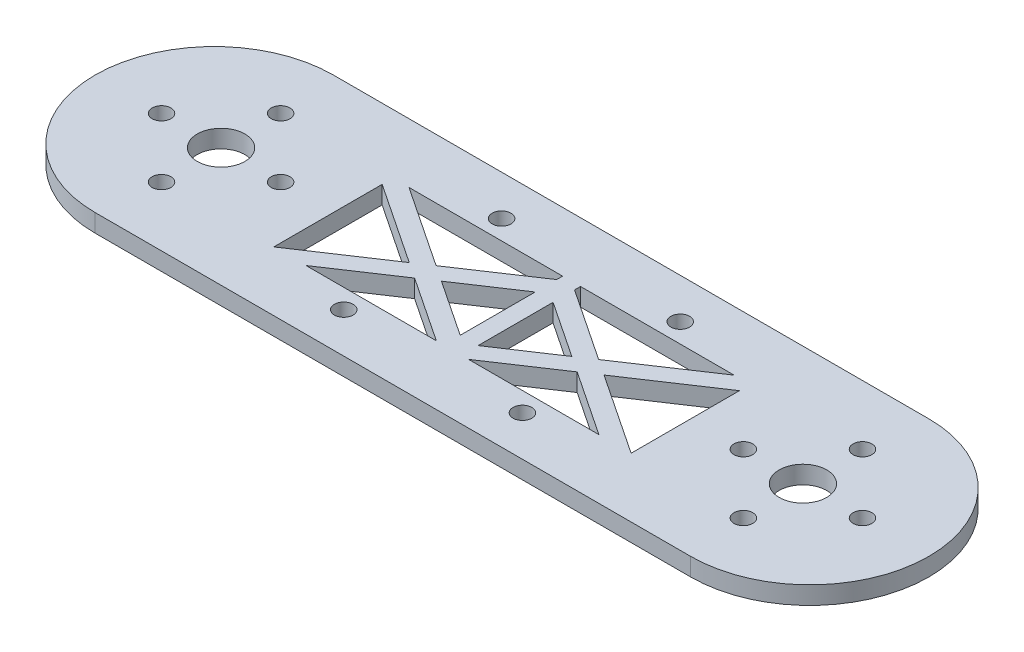
from build123d import *

# Parameters (mm, degrees)
SKETCH1_R           = 1.575
SKETCH1_R_2         = 4
BOSS_EXTRUDE1_DEPTH = 3
BOSS_EXTRUDE2_DEPTH = 3


with BuildPart() as part:
    # Sketch1 → Boss-Extrude1 (new body)
    with BuildSketch(Plane(origin=(0, 0, 0), x_dir=(1, 0, 0), z_dir=(0, 1, 0))):
        with BuildLine():
            Line((-15, 20), (-50, 20))
            ThreePointArc((-50, 20), (-70, 0), (-50, -20))
            Line((-50, -20), (50, -20))
            ThreePointArc((50, -20), (70, 0), (50, 20))
            Line((50, 20), (-15, 20))
        make_face()
        with Locations(Location((-48.85, -10, 0), (0, 0, 270))):
            Circle(SKETCH1_R, mode=Mode.SUBTRACT)
        with Locations(Location((-15, -13.25, 0), (0, 0, 270))):
            Circle(SKETCH1_R, mode=Mode.SUBTRACT)
        with BuildLine():
            ThreePointArc((-37.275, 0), (-38.85, -1.575), (-40.425, 0))
            ThreePointArc((-40.425, 0), (-38.85, 1.575), (-37.275, 0))
        make_face(mode=Mode.SUBTRACT)
        Polygon((-2.704163457, -10), (-24.591673087, -10), (-13.647918272, -2.704163457), align=None, mode=Mode.SUBTRACT)
        Polygon((-30, -10), (-30, 8.197224362), (-16.352081728, -0.901387819), align=None, mode=Mode.SUBTRACT)
        Polygon((-27.295836543, 10), (27.295836543, 10), (13.647918272, 0.901387819), (1.5, 9), (1.5, 5.394448725), (10.943754815, -0.901387819), (1.5, -7.197224362), (1.5, -10), (-1.5, -10), (-1.5, -7.197224362), (-10.943754815, -0.901387819), (-1.5, 5.394448725), (-1.5, 9), (-13.647918272, 0.901387819), align=None, mode=Mode.SUBTRACT)
        with Locations(Location((15, -13.25, 0), (0, 0, 270))):
            Circle(SKETCH1_R, mode=Mode.SUBTRACT)
        with Locations(Location((48.85, -10, 0), (0, 0, 270))):
            Circle(SKETCH1_R, mode=Mode.SUBTRACT)
        Polygon((24.591673087, -10), (2.704163457, -10), (13.647918272, -2.704163457), align=None, mode=Mode.SUBTRACT)
        Polygon((30, 8.197224362), (30, -10), (16.352081728, -0.901387819), align=None, mode=Mode.SUBTRACT)
        with Locations(Location((58.85, 0, 0), (0, 0, 270))):
            Circle(SKETCH1_R, mode=Mode.SUBTRACT)
        with Locations(Location((-58.85, 0, 0), (0, 0, 270))):
            Circle(SKETCH1_R, mode=Mode.SUBTRACT)
        with Locations(Location((-48.85, 0, 0), (0, 0, 270))):
            Circle(SKETCH1_R_2, mode=Mode.SUBTRACT)
        with Locations(Location((-48.85, 10, 0), (0, 0, 270))):
            Circle(SKETCH1_R, mode=Mode.SUBTRACT)
        with Locations(Location((-15, 13.25, 0), (0, 0, 270))):
            Circle(SKETCH1_R, mode=Mode.SUBTRACT)
        with BuildLine():
            ThreePointArc((37.275, 0), (38.85, 1.575), (40.425, 0))
            ThreePointArc((40.425, 0), (38.85, -1.575), (37.275, 0))
        make_face(mode=Mode.SUBTRACT)
        with Locations(Location((48.85, 0, 0), (0, 0, 270))):
            Circle(SKETCH1_R_2, mode=Mode.SUBTRACT)
        with Locations(Location((15, 13.25, 0), (0, 0, 270))):
            Circle(SKETCH1_R, mode=Mode.SUBTRACT)
        with Locations(Location((48.85, 10, 0), (0, 0, 270))):
            Circle(SKETCH1_R, mode=Mode.SUBTRACT)
    extrude(amount=BOSS_EXTRUDE1_DEPTH)

    # Sketch1<3> → Boss-Extrude2 (add)
    with BuildSketch(Plane(origin=(0, 0, 0), x_dir=(1, 0, 0), z_dir=(0, 1, 0))):
        Polygon((-1.5, -10), (0, -10), (0, 10), (-1.5, 9), (-1.5, 5.394448725), (-1.5, -7.197224362), align=None)
        Polygon((0, 10), (0, -10), (1.5, -10), (1.5, -7.197224362), (1.5, 5.394448725), (1.5, 9), align=None)
        Polygon((1.5, 10), (0, 10), (1.5, 9), align=None)
        Polygon((-1.5, 9), (0, 10), (-1.5, 10), align=None)
    extrude(amount=BOSS_EXTRUDE2_DEPTH)


solid = part.part
